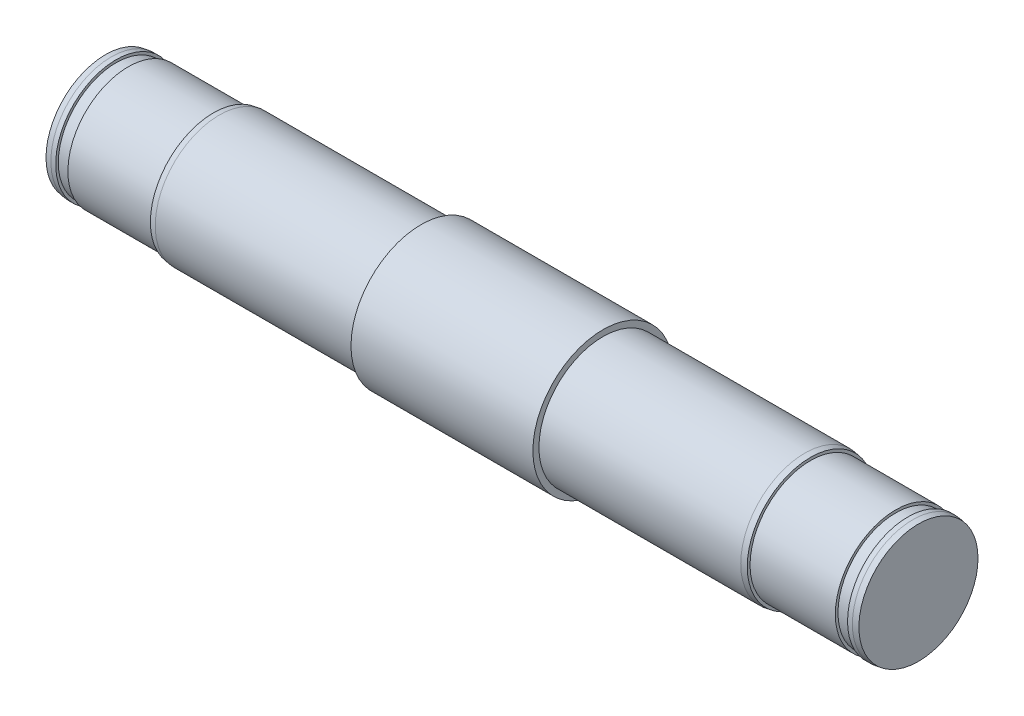
from build123d import *
from OCP.BRepFilletAPI import BRepFilletAPI_MakeChamfer

# Parameters (mm, degrees)
CHAMFER_1_SIZE  = 1
CHAMFER_1_SIZE2 = 0.176326981
CHAMFER_3_SIZE  = 1
CHAMFER_3_SIZE2 = 0.176326981
SKETCH_2_W      = 2.15
SKETCH_2_H      = 1.1
SCALE4_SCALE_X  = 0.8
SCALE4_SCALE_Y  = 0.68
SCALE4_SCALE_Z  = 0.68


with BuildPart() as part:
    # Эскиз1 → Повернуть1 (revolve)
    with BuildSketch(Plane.XY):
        Polygon((0, 0), (0, 14.5), (16, 14.5), (16, 13.25), (52.5, 13.25), (52.5, 12.5), (71.5, 12.5), (71.5, 0), align=None)
    revolve(axis=Axis((0, 0, 0), (1, 0, 0)))

    # Зеркальное отражение1: part across plane


with BuildPart() as part_1:
    add(part.part)
    add(part.part.mirror(Plane(origin=(0, 0, 0), x_dir=(0, 0, 1), z_dir=(1, 0, 0))))

    # Фаска1: one chamfer whose edges measure the first distance from different faces: ONE call of the kernel's chamfer builder (chamfer() names one face for all edges)
    chamfer_1_edges_1 = [part_1.edges().sort_by_distance(p)[0] for p in [
        (71.5, -12.5, 0),
    ]]
    chamfer_1_side_1 = [part_1.faces().sort_by_distance(p)[0] for p in [
        (62, -12.5, 0),
    ]]
    chamfer_1_edges_2 = [part_1.edges().sort_by_distance(p)[0] for p in [
        (-71.5, -12.5, 0),
    ]]
    chamfer_1_side_2 = [part_1.faces().sort_by_distance(p)[0] for p in [
        (-62, -12.5, 0),
    ]]
    chamfer_1 = BRepFilletAPI_MakeChamfer(part_1.part.solid().wrapped)
    for e in chamfer_1_edges_1:
        chamfer_1.Add(CHAMFER_1_SIZE, CHAMFER_1_SIZE2, e.wrapped, chamfer_1_side_1[0].wrapped)  # the first distance lies on this face
    for e in chamfer_1_edges_2:
        chamfer_1.Add(CHAMFER_1_SIZE, CHAMFER_1_SIZE2, e.wrapped, chamfer_1_side_2[0].wrapped)  # the first distance lies on this face
    add(Compound.cast(chamfer_1.Shape()), mode=Mode.REPLACE)

    # Фаска3: one chamfer whose edges measure the first distance from different faces: ONE call of the kernel's chamfer builder (chamfer() names one face for all edges)
    chamfer_3_edges_1 = [part_1.edges().sort_by_distance(p)[0] for p in [
        (52.5, -13.25, 0),
    ]]
    chamfer_3_side_1 = [part_1.faces().sort_by_distance(p)[0] for p in [
        (34.25, -13.25, 0),
    ]]
    chamfer_3_edges_2 = [part_1.edges().sort_by_distance(p)[0] for p in [
        (-52.5, -13.25, 0),
    ]]
    chamfer_3_side_2 = [part_1.faces().sort_by_distance(p)[0] for p in [
        (-34.25, -13.25, 0),
    ]]
    chamfer_3 = BRepFilletAPI_MakeChamfer(part_1.part.solid().wrapped)
    for e in chamfer_3_edges_1:
        chamfer_3.Add(CHAMFER_3_SIZE, CHAMFER_3_SIZE2, e.wrapped, chamfer_3_side_1[0].wrapped)  # the first distance lies on this face
    for e in chamfer_3_edges_2:
        chamfer_3.Add(CHAMFER_3_SIZE, CHAMFER_3_SIZE2, e.wrapped, chamfer_3_side_2[0].wrapped)  # the first distance lies on this face
    add(Compound.cast(chamfer_3.Shape()), mode=Mode.REPLACE)

    # Эскиз2 → Вырез-Повернуть1 (revolve, cut)
    with BuildSketch(Plane.XY):
        with Locations((68.575, 12.5)):
            Rectangle(SKETCH_2_W, SKETCH_2_H)
    cut_revolve_1 = revolve(axis=Axis((0, 0, 0), (1, 0, 0)), mode=Mode.SUBTRACT)

    # Зеркальное отражение2: Вырез-Повернуть1 across plane
    add(cut_revolve_1.mirror(Plane(origin=(0, 0, 0), x_dir=(0, 0, 1), z_dir=(1, 0, 0))), mode=Mode.SUBTRACT)


with BuildPart() as part_2:
    # Scale4: scaled about (0, 0, 0)
    add(part_1.part.scale((SCALE4_SCALE_X, SCALE4_SCALE_Y, SCALE4_SCALE_Z), about=(0, 0, 0)))


solid = part_2.part
